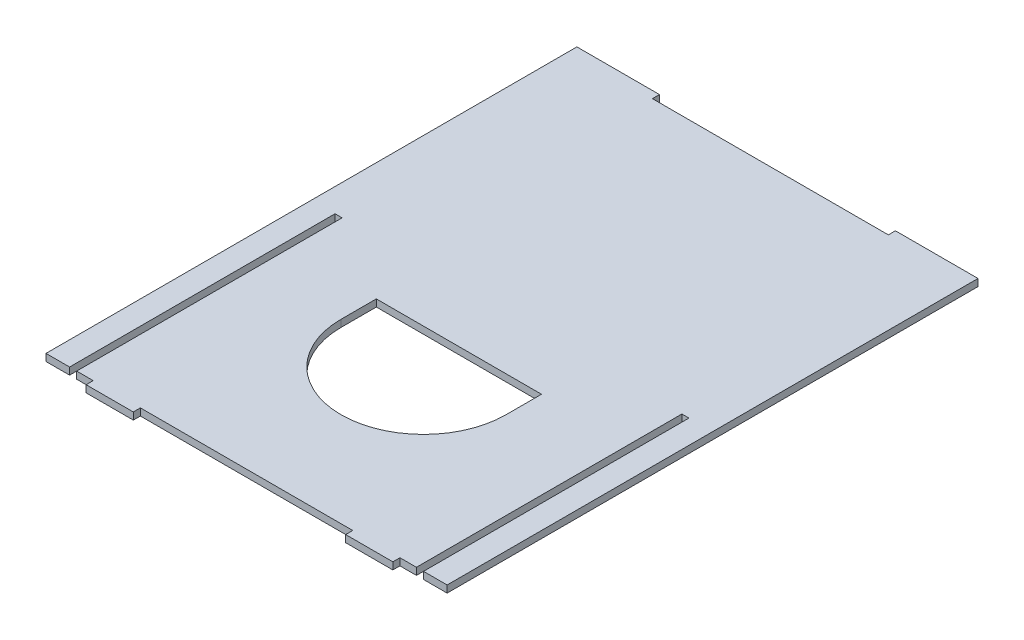
from build123d import *

# Parameters (mm, degrees)
BOSS_EXTRUDE1_DEPTH = 6
SKETCH2_W           = 6
SKETCH2_H           = 225
CUT_EXTRUDE1_DEPTH  = 6
LPATTERN1_COUNT     = 2
LPATTERN1_PITCH     = 294
SKETCH3_W           = 200
SKETCH3_H           = 6
CUT_EXTRUDE2_DEPTH  = 6


with BuildPart() as part:
    # Sketch1 → Boss-Extrude1 (new body)
    with BuildSketch(Plane(origin=(0, 0, 0), x_dir=(1, 0, 0), z_dir=(0, 1, 0))):
        Polygon((300, 0), (300, -6), (260, -6), (260, 0), (80, 0), (80, -6), (40, -6), (40, 0), (0, 0), (0, 450), (340, 450), (340, 0), align=None)
    extrude(amount=BOSS_EXTRUDE1_DEPTH)

    # Sketch2 → Cut-Extrude1 (cut)
    with BuildSketch(Plane(origin=(0, 6, 0), x_dir=(1, 0, 0), z_dir=(0, 1, 0))):
        with Locations((23, 112.5)):
            Rectangle(SKETCH2_W, SKETCH2_H)
    cut_extrude1 = extrude(amount=-CUT_EXTRUDE1_DEPTH, mode=Mode.SUBTRACT)

    # LPattern1: Cut-Extrude1 ×2
    with Locations(*[(i * LPATTERN1_PITCH, 0, 0) for i in range(1, LPATTERN1_COUNT)]):
        add(cut_extrude1, mode=Mode.SUBTRACT)

    # Sketch3 → Cut-Extrude2 (cut)
    with BuildSketch(Plane(origin=(0, 6, 0), x_dir=(1, 0, 0), z_dir=(0, 1, 0))):
        with BuildLine():
            Line((100, 150), (100, 180))
            Line((100, 180), (240, 180))
            Line((240, 180), (240, 150))
            ThreePointArc((240, 150), (170, 80), (100, 150))
        make_face()
        with Locations((170, 447)):
            Rectangle(SKETCH3_W, SKETCH3_H)
    extrude(amount=-CUT_EXTRUDE2_DEPTH, mode=Mode.SUBTRACT)


solid = part.part
